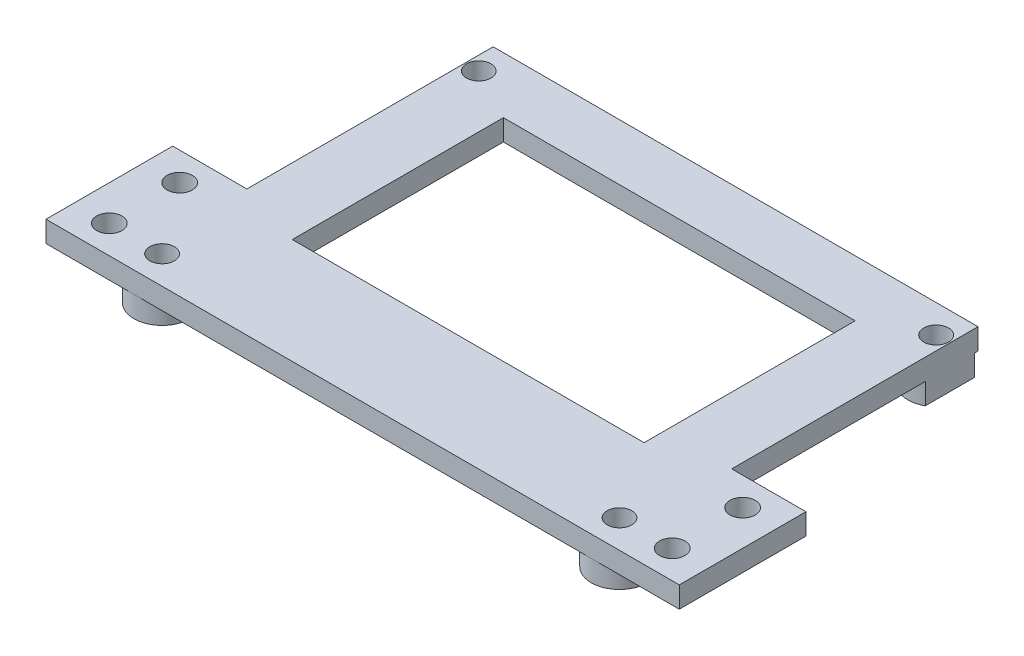
from build123d import *

# Parameters (mm, degrees)
SKETCH1_W                 = 90
SKETCH1_H                 = 18
BOSS_EXTRUDE1_DEPTH       = 3
SKETCH1_3_W               = 69.7
SKETCH1_3_H               = 18
BOSS_EXTRUDE2_DEPTH       = 8
M3_CLEARANCE_HOLE1_D      = 3.6
M3_CLEARANCE_HOLE1_DEPTH  = 10
M3_CLEARANCE_HOLE1_TIP    = 1.081549114
SKETCH6_W                 = 69.7
SKETCH6_H                 = 37
BOSS_EXTRUDE3_DEPTH       = 5
SKETCH9_R                 = 4
BOSS_EXTRUDE4_DEPTH       = 3
F_3_0MM_DOWEL_HOLE1_D     = 3.5
F_3_0MM_DOWEL_HOLE1_DEPTH = 6
F_3_0MM_DOWEL_HOLE1_TIP   = 1.051506083
SKETCH12_W                = 50
SKETCH12_H                = 30
CUT_EXTRUDE1_DEPTH        = 65.845971347
CUT_EXTRUDE2_DEPTH        = 93.498770262
SKETCH15_W                = 69.7
SKETCH15_H                = 3
CUT_EXTRUDE3_DEPTH        = 2
SKETCH16_W                = 35
SKETCH16_H                = 8.236372104
CUT_EXTRUDE4_DEPTH        = 0.4


with BuildPart() as part:
    # Sketch1 → Boss-Extrude1 (new body)
    with BuildSketch(Plane(origin=(0, 0, 0), x_dir=(1, 0, 0), z_dir=(0, 1, 0))):
        Rectangle(SKETCH1_W, SKETCH1_H)
    extrude(amount=BOSS_EXTRUDE1_DEPTH)

    # Sketch1<3> → Boss-Extrude2 (add)
    with BuildSketch(Plane(origin=(0, 0, 0), x_dir=(1, 0, 0), z_dir=(0, 1, 0))):
        Rectangle(SKETCH1_3_W, SKETCH1_3_H)
    extrude(amount=BOSS_EXTRUDE2_DEPTH)

    # M3 Clearance Hole1
    with Locations(Plane(origin=(0, 3, 0), x_dir=(1, 0, 0), z_dir=(0, 1, 0))):
        with Locations((-40, 5), (-40, -5), (40, -5), (40, 5)):
            Hole(M3_CLEARANCE_HOLE1_D / 2, depth=M3_CLEARANCE_HOLE1_DEPTH)
            with Locations((0, 0, -(M3_CLEARANCE_HOLE1_DEPTH + M3_CLEARANCE_HOLE1_TIP / 2))):  # 118° drill point
                Cone(0, M3_CLEARANCE_HOLE1_D / 2, M3_CLEARANCE_HOLE1_TIP, mode=Mode.SUBTRACT)

    # Sketch6 → Boss-Extrude3 (add)
    with BuildSketch(Plane.XZ):
        with Locations((0, -27.5)):
            Rectangle(SKETCH6_W, SKETCH6_H)
    extrude(amount=-BOSS_EXTRUDE3_DEPTH)

    # Sketch9 → Boss-Extrude4 (add)
    with BuildSketch(Plane.XZ):
        with Locations((-32.5, 5)):
            Circle(SKETCH9_R)
        with Locations((32.5, 5)):
            Circle(SKETCH9_R)
        with BuildLine():
            Line((-34.85, -36.763103338), (-34.85, -43.236896662))
            ThreePointArc((-34.85, -43.236896662), (-28.5, -40), (-34.85, -36.763103338))
        make_face()
        with BuildLine():
            ThreePointArc((34.85, -36.763103338), (28.5, -40), (34.85, -43.236896662))
            Line((34.85, -43.236896662), (34.85, -36.763103338))
        make_face()
    extrude(amount=BOSS_EXTRUDE4_DEPTH)

    # Ø3.0mm Dowel Hole1
    with Locations(Plane(origin=(0, -3, 0), x_dir=(-1, 0, 0), z_dir=(0, -1, 0))):
        with Locations((-32.5, -5), (32.5, -5), (32.5, 40), (-32.5, 40)):
            Hole(F_3_0MM_DOWEL_HOLE1_D / 2, depth=F_3_0MM_DOWEL_HOLE1_DEPTH)
            with Locations((0, 0, -(F_3_0MM_DOWEL_HOLE1_DEPTH + F_3_0MM_DOWEL_HOLE1_TIP / 2))):  # 118° drill point
                Cone(0, F_3_0MM_DOWEL_HOLE1_D / 2, F_3_0MM_DOWEL_HOLE1_TIP, mode=Mode.SUBTRACT)

    # Sketch12 → Cut-Extrude1 (cut, through all)
    with BuildSketch(Plane.XZ):
        with Locations((0, -21)):
            Rectangle(SKETCH12_W, SKETCH12_H)
    extrude(amount=-CUT_EXTRUDE1_DEPTH, mode=Mode.SUBTRACT)

    # Sketch14 → Cut-Extrude2 (cut, through all)
    with BuildSketch(Plane.ZY.offset(34.85)):
        Polygon((9, 3), (9, 8), (-9, 8), (-9, 5), (-46, 5), (-46, 3), (-9, 3), align=None)
    extrude(amount=-CUT_EXTRUDE2_DEPTH, mode=Mode.SUBTRACT)

    # Sketch15 → Cut-Extrude3 (cut)
    with BuildSketch(Plane(origin=(0, 0, -46), x_dir=(-1, 0, 0), z_dir=(0, 0, -1))):
        with Locations((0, 1.5)):
            Rectangle(SKETCH15_W, SKETCH15_H)
    extrude(amount=-CUT_EXTRUDE3_DEPTH, mode=Mode.SUBTRACT)

    # Sketch16 → Cut-Extrude4 (cut)
    with BuildSketch(Plane(origin=(34.85, 0, 0), x_dir=(0, 0, -1), z_dir=(1, 0, 0))):
        with Locations((26.5, -1.118186052)):
            Rectangle(SKETCH16_W, SKETCH16_H)
    cut_extrude4 = extrude(amount=-CUT_EXTRUDE4_DEPTH, mode=Mode.SUBTRACT)

    # Mirror1: Cut-Extrude4 across plane
    add(cut_extrude4.mirror(Plane(origin=(0, 0, 0), x_dir=(0, 0, 1), z_dir=(1, 0, 0))), mode=Mode.SUBTRACT)


solid = part.part
